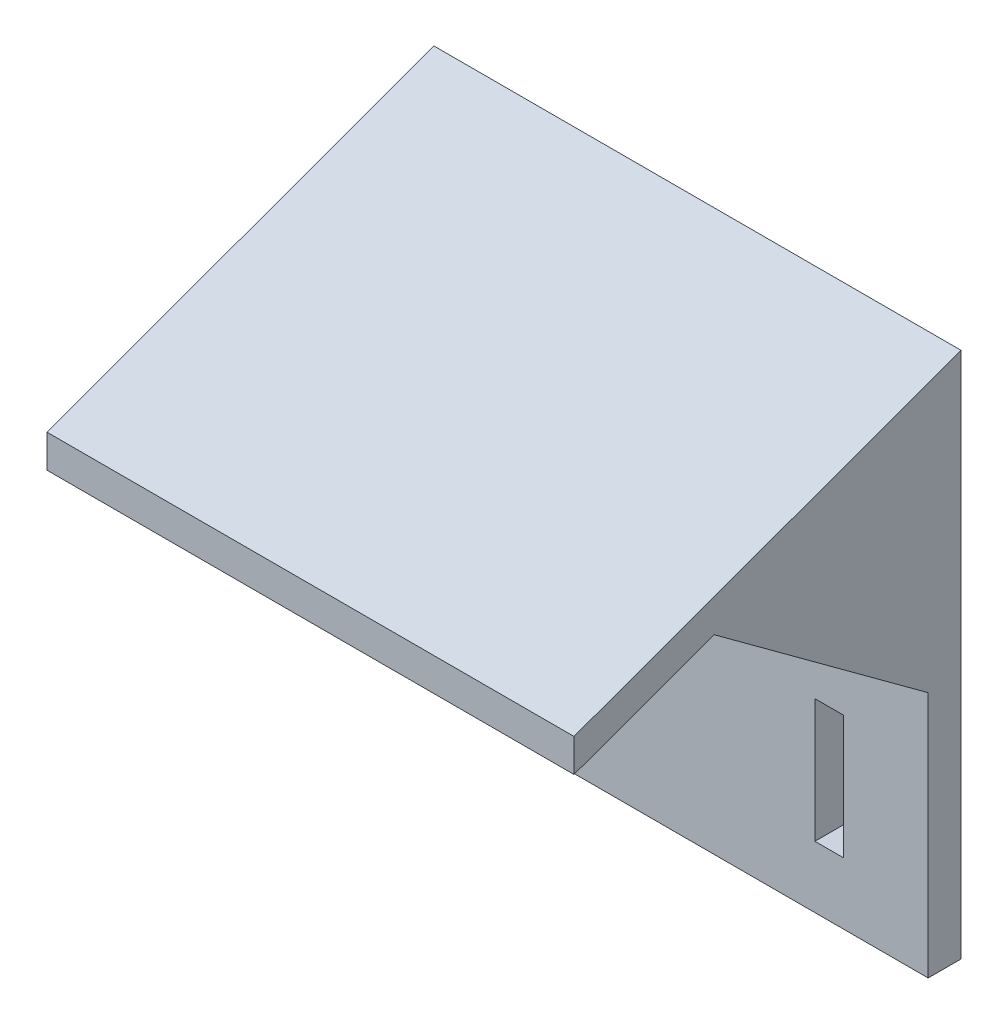
from build123d import *

# Parameters (mm, degrees)
BOSS_EXTRUDE1_DEPTH = 32
SKETCH2_W           = 3.5
SKETCH2_H           = 15
CUT_EXTRUDE1_DEPTH  = 86.609578903


with BuildPart() as part:
    # Sketch1 → Boss-Extrude1 (new, symmetric)
    with BuildSketch(Plane(origin=(0, 0, 0), x_dir=(0, 0, -1), z_dir=(1, 0, 0))):
        Polygon((0, 0), (-4, 0), (-4, 30), (-30, 49.1), (-47, 42.9), (-47, 46.9), (0, 64), align=None)
    extrude(amount=BOSS_EXTRUDE1_DEPTH, both=True)

    # Sketch2 → Cut-Extrude1 (cut, through all)
    with BuildSketch(Plane(origin=(0, 0, 0), x_dir=(-1, 0, 0), z_dir=(0, 0, -1))):
        with Locations((20, 15)):
            Rectangle(SKETCH2_W, SKETCH2_H)
        with Locations((-20, 15)):
            Rectangle(SKETCH2_W, SKETCH2_H)
    extrude(amount=-CUT_EXTRUDE1_DEPTH, mode=Mode.SUBTRACT)


solid = part.part
